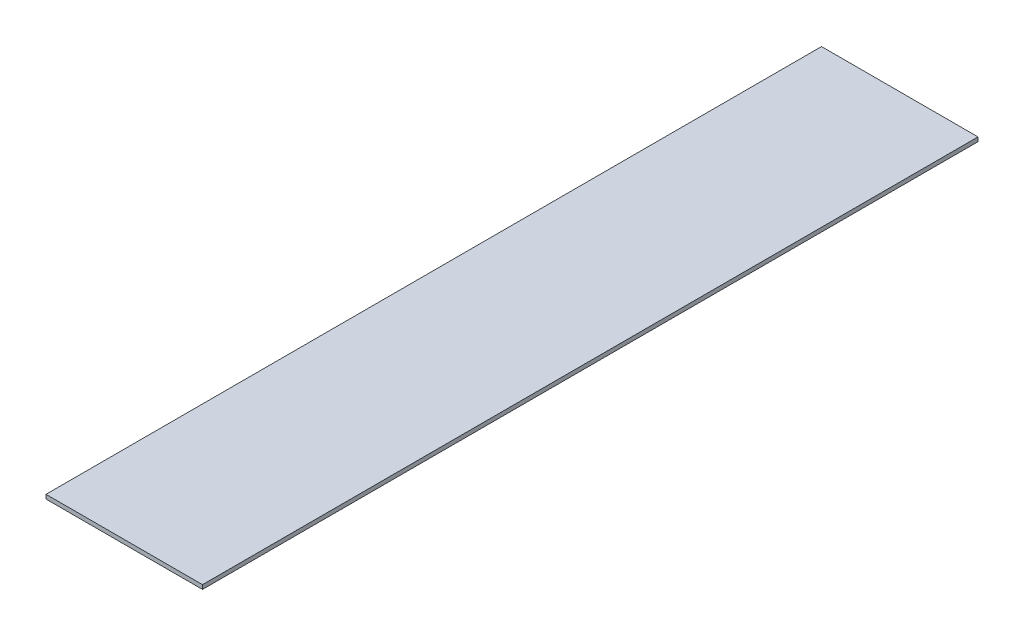
from build123d import *

# Parameters (mm, degrees)
SKETCH1_W           = 113
SKETCH1_H           = 560
BOSS_EXTRUDE1_DEPTH = 3


with BuildPart() as part:
    # Sketch1 → Boss-Extrude1 (new body)
    with BuildSketch(Plane(origin=(0, 0, 0), x_dir=(1, 0, 0), z_dir=(0, 1, 0))):
        with Locations((56.5, 280)):
            Rectangle(SKETCH1_W, SKETCH1_H)
    extrude(amount=BOSS_EXTRUDE1_DEPTH)


solid = part.part
